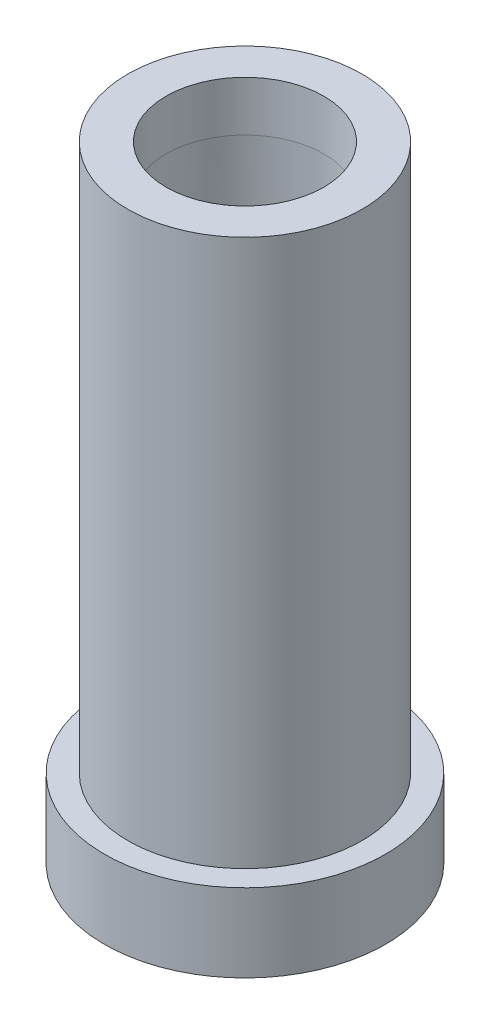
from build123d import *

# Parameters (mm, degrees)
CUT_EXTRUDE1_REACH = 43.976
SKETCH2_R          = 5.05


with BuildPart() as part:
    # Sketch1 → Revolve1 (revolve)
    with BuildSketch(Plane.XY, mode=Mode.PRIVATE) as revolve1_sk:
        Polygon((0, 0), (9, 0), (9, 5), (7.5, 5), (7.5, 40), (0, 40), align=None)
    revolve(revolve1_sk.sketch.rotate(Axis((0, 45, 0), (0, -1, 0)), 180), axis=Axis((0, 45, 0), (0, -1, 0)))

    # Sketch2 → Cut-Extrude1 (cut, up to next)
    with BuildSketch(Plane(origin=(0, 40, 0), x_dir=(1, 0, 0), z_dir=(0, 1, 0)), mode=Mode.PRIVATE) as cut_extrude1_sk1:
        with Locations(Location((0, 0, 0), (0, 0, 270))):
            Circle(SKETCH2_R)
    cut_extrude1_tool1 = extrude(cut_extrude1_sk1.sketch, amount=-CUT_EXTRUDE1_REACH, mode=Mode.PRIVATE) & part.part
    add(cut_extrude1_tool1.solids().sort_by_distance((0, 40, 0))[0], mode=Mode.SUBTRACT)

    # Cut-Sweep1: sweep along a path in Sketch4
    with BuildLine(Plane(origin=(0, 40, 0), x_dir=(1, 0, 0), z_dir=(0, 1, 0))) as cut_sweep1_path:
        CenterArc((0, 0), 5.05, 0, 360)
    # Sketch3 → Cut-Sweep1 (sweep, cut)
    with BuildSketch(Plane.XY):
        Polygon((5.05, 36.8), (6.013641914, 0), (5.05, 0), align=None)
    sweep(path=cut_sweep1_path.line, mode=Mode.SUBTRACT)


solid = part.part
